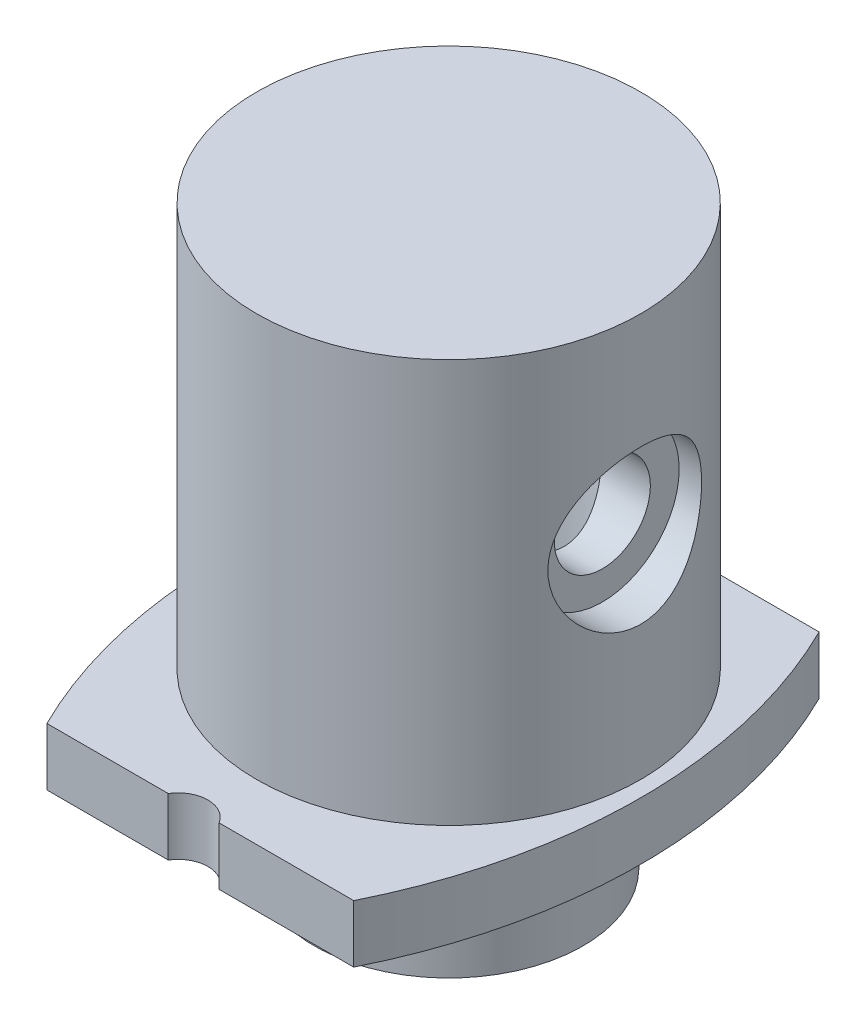
from build123d import *

# Parameters (mm, degrees)
SKETCH1_R           = 10
BOSS_EXTRUDE1_DEPTH = 21
BOSS_EXTRUDE2_DEPTH = 3
SKETCH3_R           = 7
BOSS_EXTRUDE3_DEPTH = 6
SKETCH4_R           = 6
CUT_EXTRUDE1_DEPTH  = 25
SKETCH5_R           = 4
CUT_EXTRUDE2_DEPTH  = 2
CUT_EXTRUDE3_REACH  = 34.276
SKETCH5_3_R         = 2.5
SKETCH6_R           = 1.55
CUT_EXTRUDE4_DEPTH  = 27.931170886


with BuildPart() as part:
    # Sketch1 → Boss-Extrude1 (new body)
    with BuildSketch(Plane(origin=(0, 0, 0), x_dir=(1, 0, 0), z_dir=(0, 1, 0))):
        Circle(SKETCH1_R)
    extrude(amount=BOSS_EXTRUDE1_DEPTH)

    # Sketch2 → Boss-Extrude2 (add)
    with BuildSketch(Plane.XZ):
        with BuildLine():
            Line((-7.985787442, 12.928156025), (7.985787442, 12.928156025))
            ThreePointArc((7.985787442, 12.928156025), (10.823619675, 0.815257434), (7.985787442, -11.297641157))
            Line((7.985787442, -11.297641157), (-7.985787442, -11.297641157))
            ThreePointArc((-7.985787442, -11.297641157), (-10.823619675, 0.815257434), (-7.985787442, 12.928156025))
        make_face()
    extrude(amount=BOSS_EXTRUDE2_DEPTH)

    # Sketch3 → Boss-Extrude3 (add)
    with BuildSketch(Plane.XZ.offset(3)):
        Circle(SKETCH3_R)
    extrude(amount=BOSS_EXTRUDE3_DEPTH)

    # Sketch4 → Cut-Extrude1 (cut)
    with BuildSketch(Plane.XZ.offset(9)):
        Circle(SKETCH4_R)
    extrude(amount=-CUT_EXTRUDE1_DEPTH, mode=Mode.SUBTRACT)

    # Sketch5 → Cut-Extrude2 (cut)
    with BuildSketch(Plane(origin=(10, 0, 0), x_dir=(0, 0, -1), z_dir=(1, 0, 0))):
        with Locations((0, 11)):
            Circle(SKETCH5_R)
    extrude(amount=-CUT_EXTRUDE2_DEPTH, mode=Mode.SUBTRACT)

    # Sketch5<3> → Cut-Extrude3 (cut, up to next)
    with BuildSketch(Plane(origin=(10, 0, 0), x_dir=(0, 0, -1), z_dir=(1, 0, 0)), mode=Mode.PRIVATE) as cut_extrude3_sk1:
        with Locations((0, 11)):
            Circle(SKETCH5_3_R)
    cut_extrude3_tool1 = extrude(cut_extrude3_sk1.sketch, amount=-CUT_EXTRUDE3_REACH, mode=Mode.PRIVATE) & part.part
    add(cut_extrude3_tool1.solids().sort_by_distance((10, 11, 0))[0], mode=Mode.SUBTRACT)

    # Sketch6 → Cut-Extrude4 (cut, through all)
    with BuildSketch(Plane(origin=(0, 0, 0), x_dir=(1, 0, 0), z_dir=(0, 1, 0))):
        with Locations((0.39625422, 13.700444465)):
            Circle(SKETCH6_R)
        with Locations((-0.346325383, -13.735993833)):
            Circle(SKETCH6_R)
    extrude(amount=-CUT_EXTRUDE4_DEPTH, mode=Mode.SUBTRACT)


solid = part.part
